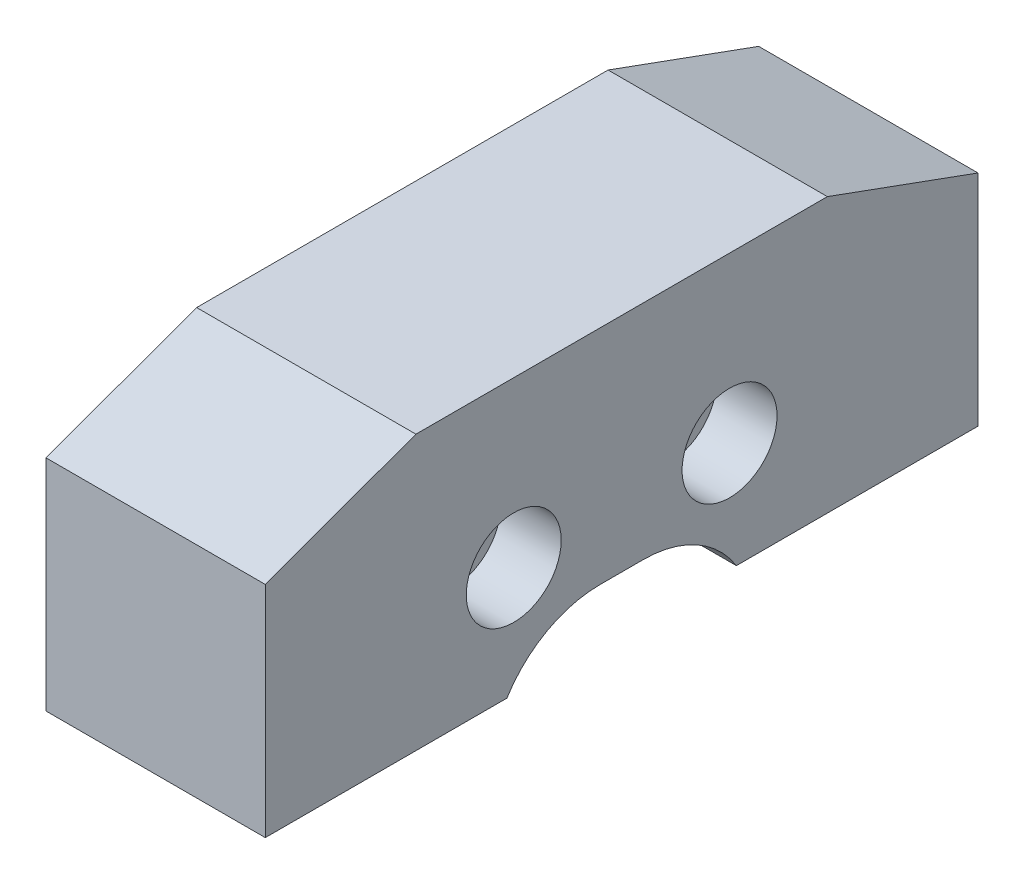
from build123d import *

# Parameters (mm, degrees)
BOSS_EXTRUDE1_DEPTH                                 = 12.7
CBORE_FOR_M6_HEX_SOCKET_HEAD_CAP_SCREW1_D           = 6.6
CBORE_FOR_M6_HEX_SOCKET_HEAD_CAP_SCREW1_CBORE_D     = 11
CBORE_FOR_M6_HEX_SOCKET_HEAD_CAP_SCREW1_CBORE_DEPTH = 7
CUT_EXTRUDE1_DEPTH                                  = 58.938313101


with BuildPart() as part:
    # Sketch1 → Boss-Extrude1 (new, symmetric)
    with BuildSketch(Plane(origin=(0, 0, 0), x_dir=(0, 0, -1), z_dir=(1, 0, 0))):
        Polygon((-41.275, 0), (41.275, 0), (41.275, 25.4), (23.828518386, 31.75), (-23.828518386, 31.75), (-41.275, 25.4), align=None)
    extrude(amount=BOSS_EXTRUDE1_DEPTH, both=True)

    # CBORE for M6 Hex Socket Head Cap Screw1 (through all)
    with Locations(Plane(origin=(12.7, 13.34258249, -21.373421522), x_dir=(0, 1, 0), z_dir=(1, 0, 0))):
        with Locations((-0.64258249, 33.873421522), (-0.64258249, 8.873421522)):
            CounterBoreHole(CBORE_FOR_M6_HEX_SOCKET_HEAD_CAP_SCREW1_D / 2, CBORE_FOR_M6_HEX_SOCKET_HEAD_CAP_SCREW1_CBORE_D / 2, CBORE_FOR_M6_HEX_SOCKET_HEAD_CAP_SCREW1_CBORE_DEPTH)

    # Sketch5 → Cut-Extrude1 (cut, through all)
    with BuildSketch(Plane(origin=(12.7, 0, 0), x_dir=(0, 0, -1), z_dir=(1, 0, 0))):
        with BuildLine():
            Line((15.2, -15), (15.2, -6.7))
            ThreePointArc((15.2, -6.7), (11.480256121, 2.280256121), (2.5, 6))
            Line((2.5, 6), (-2.5, 6))
            ThreePointArc((-2.5, 6), (-11.480256121, 2.280256121), (-15.2, -6.7))
            Line((-15.2, -6.7), (-15.2, -15))
            Line((-15.2, -15), (15.2, -15))
        make_face()
    extrude(amount=-CUT_EXTRUDE1_DEPTH, mode=Mode.SUBTRACT)


solid = part.part
